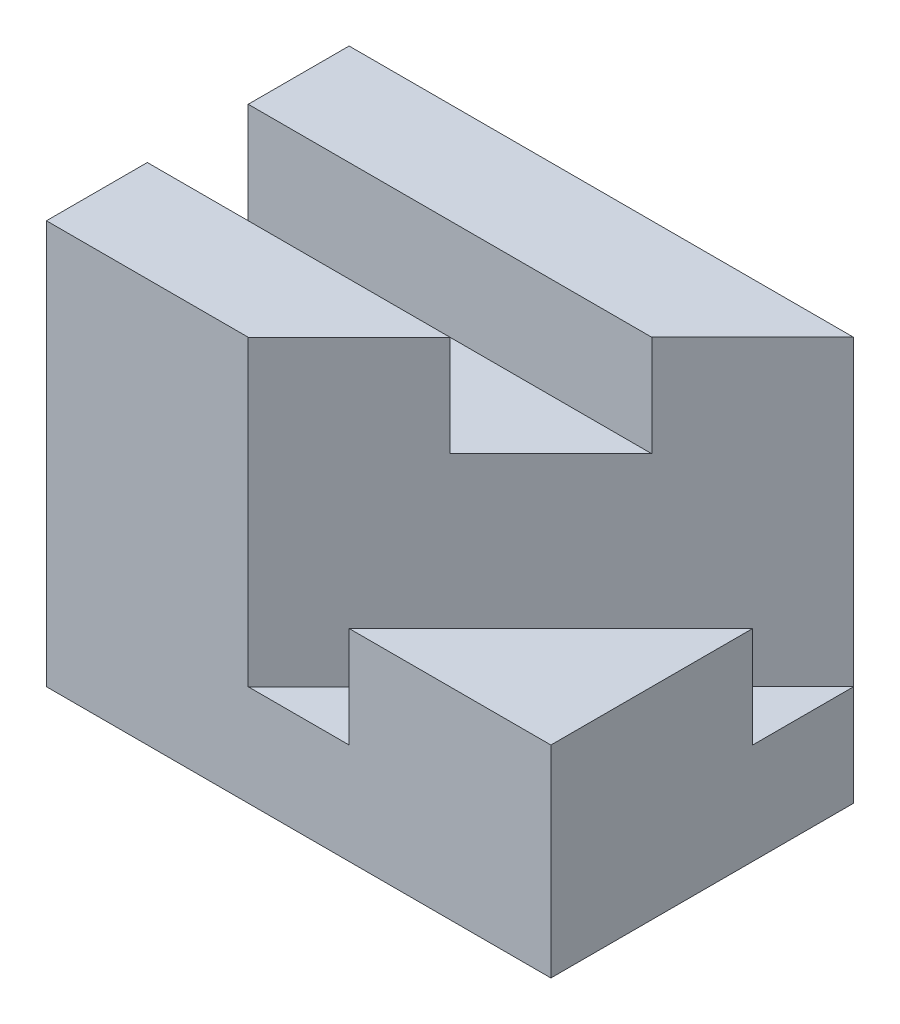
from build123d import *

# Parameters (mm, degrees)
SKETCH_1_W          = 5
SKETCH_1_H          = 3
EXTRUDE_1_DEPTH     = 1
EXTRUDE_2_DEPTH     = 1
EXTRUDE_3_DEPTH     = 3
SKETCH_4_W          = 1
SKETCH_4_H          = 1
CUT_EXTRUDE_1_DEPTH = 6


with BuildPart() as part:
    # 草圖1 → 填料-伸長1 (new body)
    with BuildSketch(Plane(origin=(0, 0, 0), x_dir=(1, 0, 0), z_dir=(0, 1, 0))):
        with Locations((2.5, 1.5)):
            Rectangle(SKETCH_1_W, SKETCH_1_H)
    extrude(amount=EXTRUDE_1_DEPTH)

    # 草圖2 → 填料-伸長2 (add)
    with BuildSketch(Plane(origin=(0, 1, 0), x_dir=(1, 0, 0), z_dir=(0, 1, 0))):
        Polygon((5, 0), (5, 2), (3, 0), align=None)
    extrude(amount=EXTRUDE_2_DEPTH)

    # 草圖3 → 填料-伸長3 (add)
    with BuildSketch(Plane(origin=(0, 1, 0), x_dir=(1, 0, 0), z_dir=(0, 1, 0))):
        Polygon((0, 0), (0, 3), (5, 3), (2, 0), align=None)
    extrude(amount=EXTRUDE_3_DEPTH)

    # 草圖4 → 除料-伸長1 (cut)
    with BuildSketch(Plane.ZY):
        with Locations((-1.5, 3.5)):
            Rectangle(SKETCH_4_W, SKETCH_4_H)
    extrude(amount=-CUT_EXTRUDE_1_DEPTH, mode=Mode.SUBTRACT)


solid = part.part
